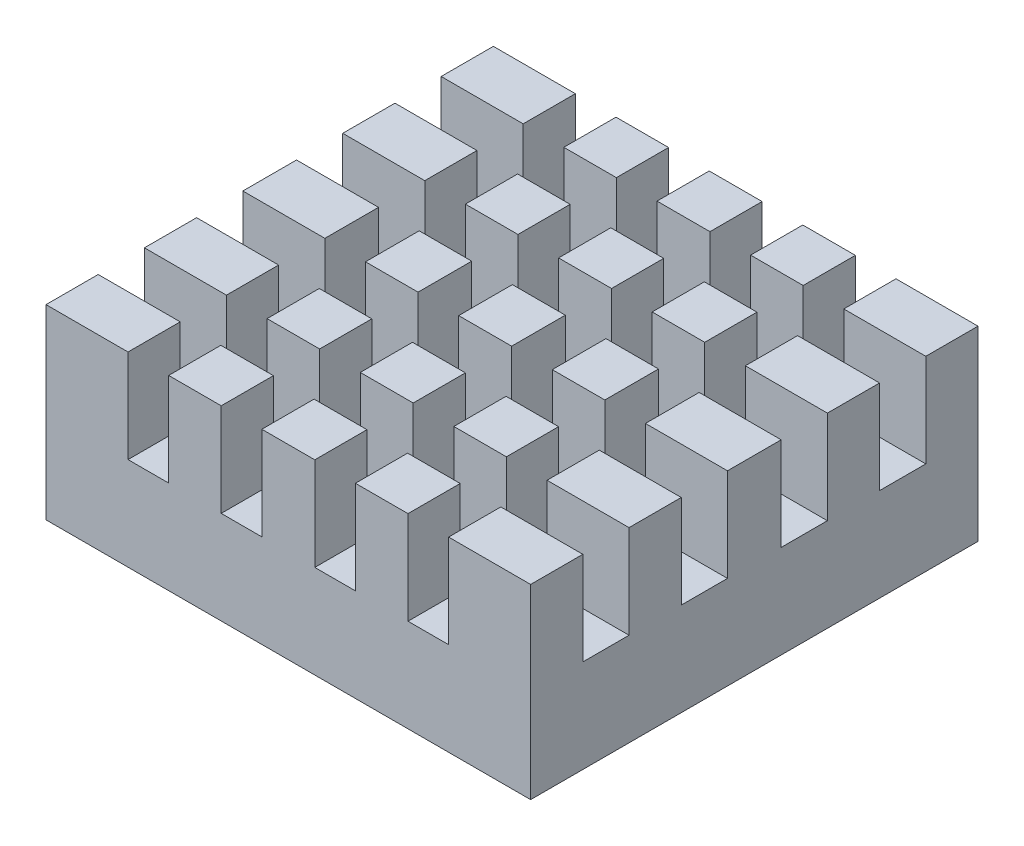
from build123d import *

# Parameters (mm, degrees)
SKETCH1_W           = 13
SKETCH1_H           = 12
BOSS_EXTRUDE1_DEPTH = 5
SKETCH2_W           = 1.41
SKETCH2_H           = 1.4
SKETCH2_H_2         = 1.44
SKETCH2_W_2         = 1.42
CUT_EXTRUDE1_DEPTH  = 2.5


with BuildPart() as part:
    # Sketch1 → Boss-Extrude1 (new body)
    with BuildSketch(Plane(origin=(0, 0, 0), x_dir=(1, 0, 0), z_dir=(0, 1, 0))):
        Rectangle(SKETCH1_W, SKETCH1_H)
    extrude(amount=BOSS_EXTRUDE1_DEPTH)

    # Sketch2 → Cut-Extrude1 (cut)
    with BuildSketch(Plane(origin=(0, 5, 0), x_dir=(1, 0, 0), z_dir=(0, 1, 0))):
        Polygon((-1.8, 6), (-0.71, 6), (-0.71, 4.6), (0.71, 4.6), (0.71, 6), (1.8, 6), (1.8, 4.6), (3.21, 4.6), (3.21, 6), (4.3, 6), (4.3, 4.6), (6.5, 4.6), (6.5, 3.36), (4.3, 3.36), (4.3, 1.96), (6.5, 1.96), (6.5, 0.72), (4.3, 0.72), (4.3, -0.72), (6.5, -0.72), (6.5, -1.96), (4.3, -1.96), (4.3, -3.36), (6.5, -3.36), (6.5, -4.6), (4.3, -4.6), (4.3, -6), (3.21, -6), (3.21, -4.6), (1.8, -4.6), (1.8, -6), (0.71, -6), (0.71, -4.6), (-0.71, -4.6), (-0.71, -6), (-1.8, -6), (-1.8, -4.6), (-3.21, -4.6), (-3.21, -6), (-4.3, -6), (-4.3, -4.6), (-6.5, -4.6), (-6.5, -3.36), (-4.3, -3.36), (-4.3, -1.96), (-6.5, -1.96), (-6.5, -0.72), (-4.3, -0.72), (-4.3, 0.72), (-6.5, 0.72), (-6.5, 1.96), (-4.3, 1.96), (-4.3, 3.36), (-6.5, 3.36), (-6.5, 4.6), (-4.3, 4.6), (-4.3, 6), (-3.21, 6), (-3.21, 4.6), (-1.8, 4.6), align=None)
        with Locations((-2.505, -2.66)):
            Rectangle(SKETCH2_W, SKETCH2_H, mode=Mode.SUBTRACT)
        with Locations((-2.505, 0)):
            Rectangle(SKETCH2_W, SKETCH2_H_2, mode=Mode.SUBTRACT)
        with Locations((-2.505, 2.66)):
            Rectangle(SKETCH2_W, SKETCH2_H, mode=Mode.SUBTRACT)
        with Locations((2.505, -2.66)):
            Rectangle(SKETCH2_W, SKETCH2_H, mode=Mode.SUBTRACT)
        with Locations((0, -2.66)):
            Rectangle(SKETCH2_W_2, SKETCH2_H, mode=Mode.SUBTRACT)
        Rectangle(SKETCH2_W_2, SKETCH2_H_2, mode=Mode.SUBTRACT)
        with Locations((0, 2.66)):
            Rectangle(SKETCH2_W_2, SKETCH2_H, mode=Mode.SUBTRACT)
        with Locations((2.505, 2.66)):
            Rectangle(SKETCH2_W, SKETCH2_H, mode=Mode.SUBTRACT)
        with Locations((2.505, 0)):
            Rectangle(SKETCH2_W, SKETCH2_H_2, mode=Mode.SUBTRACT)
    extrude(amount=-CUT_EXTRUDE1_DEPTH, mode=Mode.SUBTRACT)


solid = part.part
